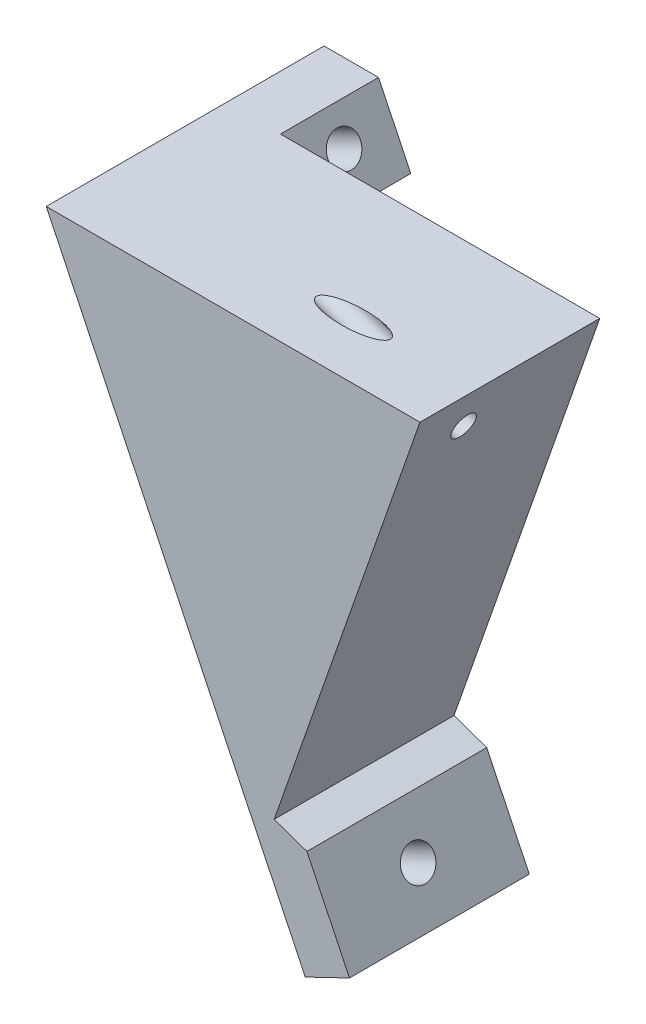
from build123d import *

# Parameters (mm, degrees)
BOSS_EXTRUDE1_DEPTH = 22
SKETCH6_W           = 12
SKETCH6_H           = 12
SKETCH6_W_2         = 22
BOSS_EXTRUDE4_DEPTH = 6
BOSS_EXTRUDE5_DEPTH = 22
SKETCH9_R           = 2
CUT_EXTRUDE9_DEPTH  = 6
SKETCH10_R          = 1.5
CUT_EXTRUDE10_DEPTH = 36
CUT_EXTRUDE11_DEPTH = 36


with BuildPart() as part:
    # Sketch1 → Boss-Extrude1 (new body)
    with BuildSketch(Plane.XY):
        Polygon((-36.238637744, 24.241346543), (-9.742760301, -30.758653457), (9.494123696, 24.241346543), align=None)
    extrude(amount=BOSS_EXTRUDE1_DEPTH)

    # Sketch6 → Boss-Extrude4 (add)
    with BuildSketch(Plane(origin=(-19.934259386, -9.603194429, 0), x_dir=(0, 0, 1), z_dir=(-0.9009094793526655, -0.4340070391278342, 0))):
        with Locations((-6, 31.567082762)):
            Rectangle(SKETCH6_W, SKETCH6_H)
        with Locations((11, -29.48233592)):
            Rectangle(SKETCH6_W_2, SKETCH6_H)
    extrude(amount=-BOSS_EXTRUDE4_DEPTH)


with BuildPart() as boss_extrude4_piece_1:
    # of the separate pieces the step leaves, piece 1, a body of its own (boss_extrude4_pieces)
    add(part.part.solids().sort_by_distance((-36.238637744, 24.241346543, 0))[0])



with BuildPart() as boss_extrude4_piece_2:
    # of the separate pieces the step leaves, piece 2, a body of its own (boss_extrude4_pieces)
    add(part.part.solids().sort_by_distance((-4.337303425, -28.154611222, 0))[0])


with BuildPart() as boss_extrude4_piece_1_1:
    add(boss_extrude4_piece_1.part)

    add(boss_extrude4_piece_2.part)  # Boss-Extrude5 merges Boss-Extrude4 piece 2
    # Sketch8 → Boss-Extrude5 (add)
    with BuildSketch(Plane(origin=(0, 0, 0), x_dir=(-1, 0, 0), z_dir=(0, 0, -1))):
        Polygon((9.742760301, -30.758653457), (4.337303425, -28.154611222), (8.343083331, -26.756849768), align=None)
    extrude(amount=-BOSS_EXTRUDE5_DEPTH)

    # Sketch9 → Cut-Extrude9 (cut)
    with BuildSketch(Plane(origin=(-14.52880251, -6.999152194, 0), x_dir=(0, 0, -1), z_dir=(0.9009094793526653, 0.43400703912783434, 0))):
        with Locations(Location((6, 30.567082762, 0), (0, 0, 90))):
            Circle(SKETCH9_R)
        with Locations(Location((-11, -29.48233592, 0), (0, 0, 90))):
            Circle(SKETCH9_R)
    extrude(amount=-CUT_EXTRUDE9_DEPTH, mode=Mode.SUBTRACT)

    # Sketch10 → Cut-Extrude10 (cut)
    with BuildSketch(Plane(origin=(0.904752149, -0.316447493, 0), x_dir=(0, 0, -1), z_dir=(0.9439285225355003, -0.3301498816355197, 0))):
        with Locations(Location((-15, 21.016582241, 0), (0, 0, 90))):
            Circle(SKETCH10_R)
    extrude(amount=-CUT_EXTRUDE10_DEPTH, mode=Mode.SUBTRACT)

    # Sketch11 → Cut-Extrude11 (cut)
    with BuildSketch(Plane.XY):
        Polygon((-36.238637744, 24.241346543), (-29.578701161, 24.241346543), (-30.833180868, 26.845388778), align=None)
    extrude(amount=-CUT_EXTRUDE11_DEPTH, mode=Mode.SUBTRACT)


solid = boss_extrude4_piece_1_1.part
